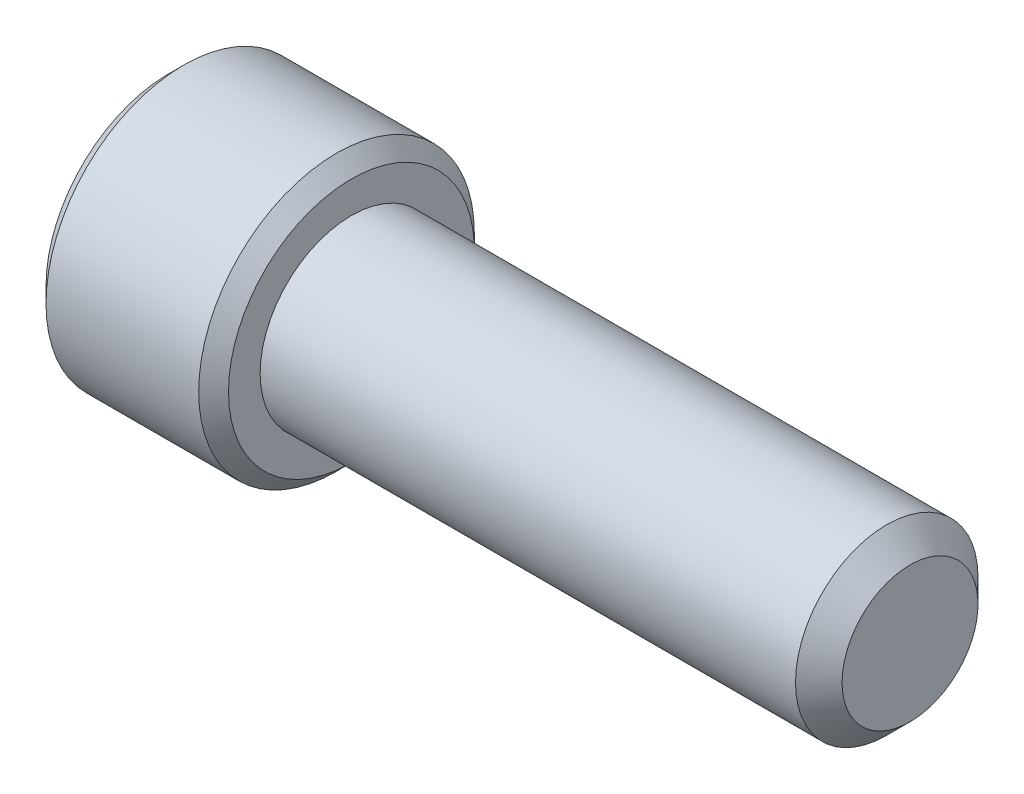
from build123d import *

# Parameters (mm, degrees)
EXTRUDE1_DEPTH = 3.81


with BuildPart() as part:
    # Sketch1 → Revolve1 (revolve)
    with BuildSketch(Plane.XY, mode=Mode.PRIVATE) as revolve1_sk:
        Polygon((12.6365, 0), (12.6365, 2.31775), (11.84275, 3.1115), (-6.4135, 3.1115), (-6.4135, 4.191), (-6.9215, 4.699), (-12.1285, 4.699), (-12.6365, 4.191), (-12.6365, 0), align=None)
    revolve(revolve1_sk.sketch.rotate(Axis((-124.874669814, 0, 0), (1, 0, 0)), 90), axis=Axis((-124.874669814, 0, 0), (1, 0, 0)))

    # Sketch2 → Extrude1 (cut)
    with BuildSketch(Plane.ZY.offset(12.6365)):
        Polygon((0, 2.749630657), (-2.38125, 1.374815329), (-2.38125, -1.374815329), (0, -2.749630657), (2.38125, -1.374815329), (2.38125, 1.374815329), align=None)
    extrude(amount=-EXTRUDE1_DEPTH, mode=Mode.SUBTRACT)


solid = part.part
